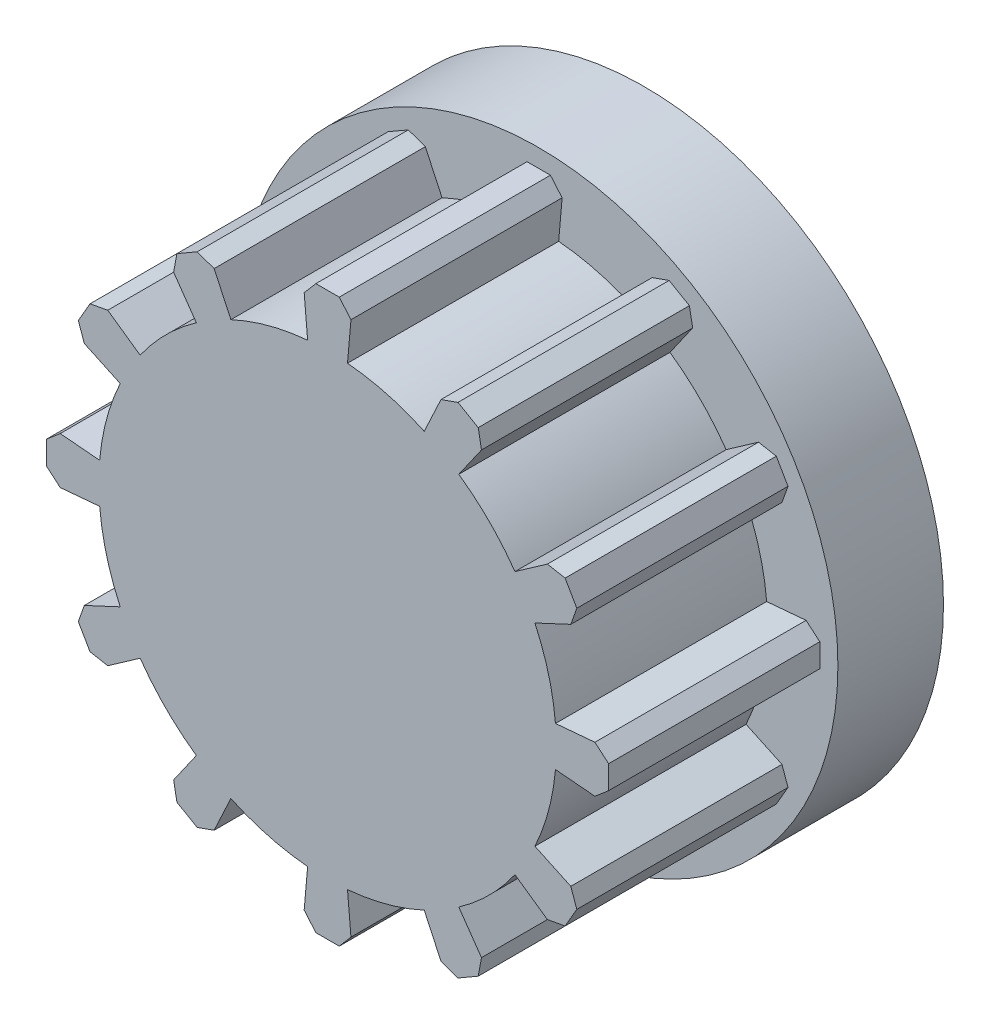
from build123d import *

# Parameters (mm, degrees)
SKETCH1_R           = 8.5
BOSS_EXTRUDE1_DEPTH = 3
CUT_EXTRUDE2_DEPTH  = 2
BOSS_EXTRUDE4_DEPTH = 6


with BuildPart() as part:
    # Sketch1 → Boss-Extrude1 (new body)
    with BuildSketch(Plane.XY):
        Circle(SKETCH1_R)
    extrude(amount=BOSS_EXTRUDE1_DEPTH)

    # Sketch4 → Cut-Extrude2 (cut)
    with BuildSketch(Plane(origin=(0, 0, 0), x_dir=(-1, 0, 0), z_dir=(0, 0, -1))):
        with BuildLine():
            Line((-3.25, 0.968245837), (3.25, 0.968245837))
            ThreePointArc((3.25, 0.968245837), (7, 0), (3.25, -0.968245837))
            Line((3.25, -0.968245837), (-3.25, -0.968245837))
            ThreePointArc((-3.25, -0.968245837), (-7, 0), (-3.25, 0.968245837))
        make_face()
    extrude(amount=-CUT_EXTRUDE2_DEPTH, mode=Mode.SUBTRACT)

    # Sketch2 → Boss-Extrude4 (add)
    with BuildSketch(Plane.XY.offset(3)):
        with BuildLine():
            Line((3.222464246, 6.910596876), (2.747018701, 5.891000616))
            ThreePointArc((2.747018701, 5.891000616), (1.682323793, 6.278517871), (0.566512328, 6.475265538))
            Line((0.566512328, 6.475265538), (0.664562538, 7.595984573))
            Line((0.664562538, 7.595984573), (0.332281269, 7.985492286))
            Line((0.332281269, 7.985492286), (-0.332281269, 7.985492286))
            Line((-0.332281269, 7.985492286), (-0.664562538, 7.595984573))
            Line((-0.664562538, 7.595984573), (-0.566512328, 6.475265538))
            ThreePointArc((-0.566512328, 6.475265538), (-1.682323793, 6.278517871), (-2.747018701, 5.891000616))
            Line((-2.747018701, 5.891000616), (-3.222464246, 6.910596876))
            Line((-3.222464246, 6.910596876), (-3.704982123, 7.081779816))
            Line((-3.704982123, 7.081779816), (-4.280510164, 6.749498547))
            Line((-4.280510164, 6.749498547), (-4.373520327, 6.246034338))
            Line((-4.373520327, 6.246034338), (-3.728246836, 5.324488288))
            ThreePointArc((-3.728246836, 5.324488288), (-4.596194078, 4.596194078), (-5.324488288, 3.728246836))
            Line((-5.324488288, 3.728246836), (-6.246034338, 4.373520327))
            Line((-6.246034338, 4.373520327), (-6.749498547, 4.280510164))
            Line((-6.749498547, 4.280510164), (-7.081779816, 3.704982123))
            Line((-7.081779816, 3.704982123), (-6.910596876, 3.222464246))
            Line((-6.910596876, 3.222464246), (-5.891000616, 2.747018701))
            ThreePointArc((-5.891000616, 2.747018701), (-6.278517871, 1.682323793), (-6.475265538, 0.566512328))
            Line((-6.475265538, 0.566512328), (-7.595984573, 0.664562538))
            Line((-7.595984573, 0.664562538), (-7.985492286, 0.332281269))
            Line((-7.985492286, 0.332281269), (-7.985492286, -0.332281269))
            Line((-7.985492286, -0.332281269), (-7.595984573, -0.664562538))
            Line((-7.595984573, -0.664562538), (-6.475265538, -0.566512328))
            ThreePointArc((-6.475265538, -0.566512328), (-6.278517871, -1.682323793), (-5.891000616, -2.747018701))
            Line((-5.891000616, -2.747018701), (-6.910596876, -3.222464246))
            Line((-6.910596876, -3.222464246), (-7.081779816, -3.704982123))
            Line((-7.081779816, -3.704982123), (-6.749498547, -4.280510164))
            Line((-6.749498547, -4.280510164), (-6.246034338, -4.373520327))
            Line((-6.246034338, -4.373520327), (-5.324488288, -3.728246836))
            ThreePointArc((-5.324488288, -3.728246836), (-4.596194078, -4.596194078), (-3.728246836, -5.324488288))
            Line((-3.728246836, -5.324488288), (-4.373520327, -6.246034338))
            Line((-4.373520327, -6.246034338), (-4.280510164, -6.749498547))
            Line((-4.280510164, -6.749498547), (-3.704982123, -7.081779816))
            Line((-3.704982123, -7.081779816), (-3.222464246, -6.910596876))
            Line((-3.222464246, -6.910596876), (-2.747018701, -5.891000616))
            ThreePointArc((-2.747018701, -5.891000616), (-1.682323793, -6.278517871), (-0.566512328, -6.475265538))
            Line((-0.566512328, -6.475265538), (-0.664562538, -7.595984573))
            Line((-0.664562538, -7.595984573), (-0.332281269, -7.985492286))
            Line((-0.332281269, -7.985492286), (0.332281269, -7.985492286))
            Line((0.332281269, -7.985492286), (0.664562538, -7.595984573))
            Line((0.664562538, -7.595984573), (0.566512328, -6.475265538))
            ThreePointArc((0.566512328, -6.475265538), (1.682323793, -6.278517871), (2.747018701, -5.891000616))
            Line((2.747018701, -5.891000616), (3.222464246, -6.910596876))
            Line((3.222464246, -6.910596876), (3.704982123, -7.081779816))
            Line((3.704982123, -7.081779816), (4.280510164, -6.749498547))
            Line((4.280510164, -6.749498547), (4.373520327, -6.246034338))
            Line((4.373520327, -6.246034338), (3.728246836, -5.324488288))
            ThreePointArc((3.728246836, -5.324488288), (4.596194078, -4.596194078), (5.324488288, -3.728246836))
            Line((5.324488288, -3.728246836), (6.246034338, -4.373520327))
            Line((6.246034338, -4.373520327), (6.749498547, -4.280510164))
            Line((6.749498547, -4.280510164), (7.081779816, -3.704982123))
            Line((7.081779816, -3.704982123), (6.910596876, -3.222464246))
            Line((6.910596876, -3.222464246), (5.891000616, -2.747018701))
            ThreePointArc((5.891000616, -2.747018701), (6.278517871, -1.682323793), (6.475265538, -0.566512328))
            Line((6.475265538, -0.566512328), (7.595984573, -0.664562538))
            Line((7.595984573, -0.664562538), (7.985492286, -0.332281269))
            Line((7.985492286, -0.332281269), (7.985492286, 0.332281269))
            Line((7.985492286, 0.332281269), (7.595984573, 0.664562538))
            Line((7.595984573, 0.664562538), (6.475265538, 0.566512328))
            ThreePointArc((6.475265538, 0.566512328), (6.278517871, 1.682323793), (5.891000616, 2.747018701))
            Line((5.891000616, 2.747018701), (6.910596876, 3.222464246))
            Line((6.910596876, 3.222464246), (7.081779816, 3.704982123))
            Line((7.081779816, 3.704982123), (6.749498547, 4.280510164))
            Line((6.749498547, 4.280510164), (6.246034338, 4.373520327))
            Line((6.246034338, 4.373520327), (5.324488288, 3.728246836))
            ThreePointArc((5.324488288, 3.728246836), (4.596194078, 4.596194078), (3.728246836, 5.324488288))
            Line((3.728246836, 5.324488288), (4.373520327, 6.246034338))
            Line((4.373520327, 6.246034338), (4.280510164, 6.749498547))
            Line((4.280510164, 6.749498547), (3.704982123, 7.081779816))
            Line((3.704982123, 7.081779816), (3.222464246, 6.910596876))
        make_face()
    extrude(amount=BOSS_EXTRUDE4_DEPTH)


solid = part.part
